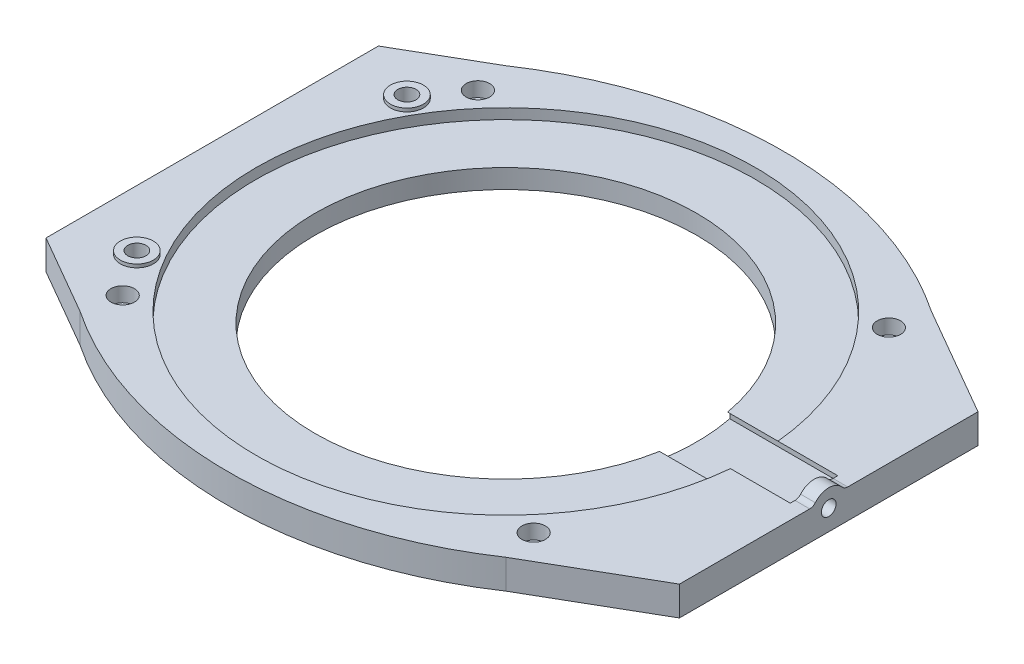
from build123d import *

# Parameters (mm, degrees)
SKETCH1_W                = 220
SKETCH1_H                = 210
BOSS_EXTRUDE1_DEPTH      = 10
SKETCH2_R                = 65
CUT_EXTRUDE1_DEPTH       = 153.397506541
SKETCH3_R                = 2.25
CUT_EXTRUDE2_DEPTH       = 153.397506541
SKETCH4_R                = 85
CUT_EXTRUDE3_DEPTH       = 3.5
SKETCH5_R                = 4
CUT_EXTRUDE4_DEPTH       = 5
BOSS_EXTRUDE2_DEPTH      = 1.14
BOSS_EXTRUDE2_DEPTH_BACK = 10
SKETCH6_R                = 5.625
CUT_EXTRUDE6_DEPTH       = 153.397506541
CUT_EXTRUDE5_DEPTH       = 146.506305169
SKETCH9_R                = 3.1
CUT_EXTRUDE7_DEPTH       = 11
BOSS_EXTRUDE3_REACH      = 147.423
SKETCH10_W               = 5
SKETCH10_H               = 46.83031672
SKETCH11_R               = 2.5
CUT_EXTRUDE8_DEPTH       = 5
SKETCH12_W               = 64.109170113
SKETCH12_H               = 200.868418625
CUT_EXTRUDE9_DEPTH       = 146.423468683
SKETCH13_R               = 2.5
CUT_EXTRUDE10_DEPTH      = 12
BOSS_EXTRUDE4_DEPTH      = 5
FILLET1_R                = 2.5


with BuildPart() as part:
    # Sketch1 → Boss-Extrude1 (new body)
    with BuildSketch(Plane(origin=(0, 0, 0), x_dir=(1, 0, 0), z_dir=(0, 1, 0))):
        Rectangle(SKETCH1_W, SKETCH1_H)
    extrude(amount=BOSS_EXTRUDE1_DEPTH)

    # Sketch2 → Cut-Extrude1 (cut, through all)
    with BuildSketch(Plane(origin=(0, 10, 0), x_dir=(1, 0, 0), z_dir=(0, 1, 0))):
        with Locations(Location((0, 0, 0), (0, 0, 270))):
            Circle(SKETCH2_R)
    extrude(amount=-CUT_EXTRUDE1_DEPTH, mode=Mode.SUBTRACT)

    # Sketch3 → Cut-Extrude2 (cut, through all)
    with BuildSketch(Plane(origin=(0, 10, 0), x_dir=(1, 0, 0), z_dir=(0, 1, 0))):
        with Locations(Location((70, 60.5, 0), (0, 0, 270))):
            Circle(SKETCH3_R)
        with Locations(Location((-70, 60.5, 0), (0, 0, 270))):
            Circle(SKETCH3_R)
        with Locations(Location((-70, -60.5, 0), (0, 0, 270))):
            Circle(SKETCH3_R)
        with Locations(Location((70, -60.5, 0), (0, 0, 270))):
            Circle(SKETCH3_R)
    extrude(amount=-CUT_EXTRUDE2_DEPTH, mode=Mode.SUBTRACT)

    # Sketch4 → Cut-Extrude3 (cut)
    with BuildSketch(Plane(origin=(0, 10, 0), x_dir=(1, 0, 0), z_dir=(0, 1, 0))):
        with Locations(Location((0, 0, 0), (0, 0, 270))):
            Circle(SKETCH4_R)
    extrude(amount=-CUT_EXTRUDE3_DEPTH, mode=Mode.SUBTRACT)

    # Sketch5 → Cut-Extrude4 (cut)
    with BuildSketch(Plane(origin=(0, 10, 0), x_dir=(1, 0, 0), z_dir=(0, 1, 0))):
        with Locations(Location((70, -60.5, 0), (0, 0, 270))):
            Circle(SKETCH5_R)
        with Locations(Location((-70, -60.5, 0), (0, 0, 270))):
            Circle(SKETCH5_R)
        with Locations(Location((-70, 60.5, 0), (0, 0, 270))):
            Circle(SKETCH5_R)
        with Locations(Location((70, 60.5, 0), (0, 0, 270))):
            Circle(SKETCH5_R)
    extrude(amount=-CUT_EXTRUDE4_DEPTH, mode=Mode.SUBTRACT)

    # Sketch6 → Boss-Extrude2 (add, two sides: drawn at the far end of the back side and taken through both)
    with BuildSketch(Plane(origin=(0, 10, 0), x_dir=(1, 0, 0), z_dir=(0, 1, 0)).offset(-BOSS_EXTRUDE2_DEPTH_BACK)):
        with Locations(Location((-79.674337148, 46, 0), (0, 0, 270))):
            Circle(SKETCH6_R)
        with Locations(Location((-79.674337148, -46, 0), (0, 0, 270))):
            Circle(SKETCH6_R)
    extrude(amount=BOSS_EXTRUDE2_DEPTH + BOSS_EXTRUDE2_DEPTH_BACK)

    # Sketch8 → Cut-Extrude6 (cut, through all)
    with BuildSketch(Plane(origin=(0, 10, 0), x_dir=(1, 0, 0), z_dir=(0, 1, 0))):
        with BuildLine():
            Line((-72.5, -72.5), (-110, -50.849364905))
            Line((-110, -50.849364905), (-110, -105))
            Line((-110, -105), (110, -105))
            Line((110, -105), (110, -50.849364905))
            Line((110, -50.849364905), (72.5, -72.5))
            ThreePointArc((72.5, -72.5), (0, -94.593790725), (-72.5, -72.5))
        make_face()
        with BuildLine():
            Line((-110, 50.849364905), (-72.5, 72.5))
            ThreePointArc((-72.5, 72.5), (0, 94.593790725), (72.5, 72.5))
            Line((72.5, 72.5), (110, 50.849364905))
            Line((110, 50.849364905), (110, 105))
            Line((110, 105), (-110, 105))
            Line((-110, 105), (-110, 50.849364905))
        make_face()
    extrude(amount=-CUT_EXTRUDE6_DEPTH, mode=Mode.SUBTRACT)

    # Sketch7 → Cut-Extrude5 (cut, through all)
    with BuildSketch(Plane(origin=(0, 0, 0), x_dir=(0, 0, -1), z_dir=(1, 0, 0))):
        Polygon((-12.5, 4), (12.5, 4), (12.5, 5.6), (8.1, 10), (-8.1, 10), (-12.5, 5.6), align=None)
    extrude(amount=CUT_EXTRUDE5_DEPTH, mode=Mode.SUBTRACT)

    # Sketch9 → Cut-Extrude7 (cut)
    with BuildSketch(Plane(origin=(0, 11.14, 0), x_dir=(1, 0, 0), z_dir=(0, 1, 0))):
        with Locations(Location((-79.674337148, 46, 0), (0, 0, 270))):
            Circle(SKETCH9_R)
        with Locations(Location((-79.674337148, -46, 0), (0, 0, 270))):
            Circle(SKETCH9_R)
    extrude(amount=-CUT_EXTRUDE7_DEPTH, mode=Mode.SUBTRACT)

    # Sketch10 → Boss-Extrude3 (add, up to next)
    with BuildSketch(Plane(origin=(0, 10, 0), x_dir=(1, 0, 0), z_dir=(0, 1, 0)), mode=Mode.PRIVATE) as boss_extrude3_sk1:
        with Locations((107.5, 0)):
            Rectangle(SKETCH10_W, SKETCH10_H)
    boss_extrude3_tool1 = extrude(boss_extrude3_sk1.sketch, amount=-BOSS_EXTRUDE3_REACH, mode=Mode.PRIVATE) - part.part
    add(boss_extrude3_tool1.solids().sort_by_distance((107.5, 10, 0))[0])

    # Sketch11 → Cut-Extrude8 (cut)
    with BuildSketch(Plane(origin=(110, 0, 0), x_dir=(0, 0, -1), z_dir=(1, 0, 0))):
        with Locations((0, 7)):
            Circle(SKETCH11_R)
    extrude(amount=-CUT_EXTRUDE8_DEPTH, mode=Mode.SUBTRACT)

    # Sketch12 → Cut-Extrude9 (cut, through all)
    with BuildSketch(Plane(origin=(0, 10, 0), x_dir=(1, 0, 0), z_dir=(0, 1, 0))):
        with Locations((-132.054585057, 3.279044808)):
            Rectangle(SKETCH12_W, SKETCH12_H)
    extrude(amount=-CUT_EXTRUDE9_DEPTH, mode=Mode.SUBTRACT)

    # Sketch13 → Cut-Extrude10 (cut)
    with BuildSketch(Plane.ZY.offset(100)):
        with Locations((-40, 5)):
            Circle(SKETCH13_R)
        with Locations((40, 5)):
            Circle(SKETCH13_R)
    extrude(amount=-CUT_EXTRUDE10_DEPTH, mode=Mode.SUBTRACT)

    # Sketch14 → Boss-Extrude4 (add)
    with BuildSketch(Plane(origin=(110, 0, 0), x_dir=(0, 0, -1), z_dir=(1, 0, 0))):
        with BuildLine():
            Line((-5.196152423, 10), (5.196152423, 10))
            ThreePointArc((5.196152423, 10), (0, 13), (-5.196152423, 10))
        make_face()
    extrude(amount=-BOSS_EXTRUDE4_DEPTH)

    # Fillet1
    fillet1_edges = [part.edges().sort_by_distance(p)[0] for p in [
        (107.5, 10, -5.196152423),
        (107.5, 10, 5.196152423),
    ]]
    fillet(fillet1_edges, radius=FILLET1_R)


solid = part.part
